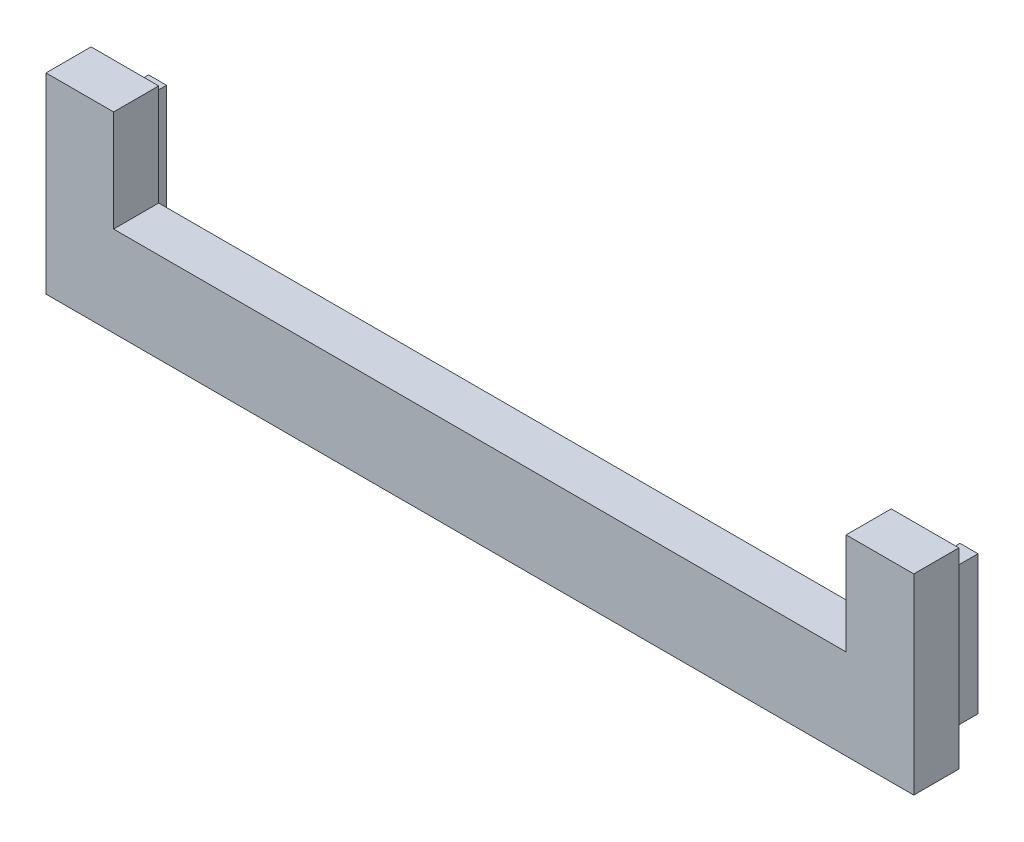
from build123d import *

# Parameters (mm, degrees)
SKETCH1_W           = 38.5
SKETCH1_H           = 8.5
BOSS_EXTRUDE1_DEPTH = 2
SKETCH2_W           = 0.8
SKETCH2_H           = 6.15
BOSS_EXTRUDE2_DEPTH = 1.7
SKETCH3_W           = 32.5
SKETCH3_H           = 4.5
CUT_EXTRUDE1_DEPTH  = 21.057791504


with BuildPart() as part:
    # Sketch1 → Boss-Extrude1 (new body)
    with BuildSketch(Plane.XY):
        Rectangle(SKETCH1_W, SKETCH1_H)
    extrude(amount=BOSS_EXTRUDE1_DEPTH)

    # Sketch2 → Boss-Extrude2 (add)
    with BuildSketch(Plane(origin=(0, 0, 0), x_dir=(-1, 0, 0), z_dir=(0, 0, -1))):
        with Locations((-18, -0.325)):
            Rectangle(SKETCH2_W, SKETCH2_H)
    boss_extrude2 = extrude(amount=BOSS_EXTRUDE2_DEPTH)

    # Mirror1: Boss-Extrude2 across plane
    add(boss_extrude2.mirror(Plane(origin=(0, 0, 0), x_dir=(0, 0, 1), z_dir=(1, 0, 0))))

    # Sketch3 → Cut-Extrude1 (cut, through all)
    with BuildSketch(Plane.XY.offset(2)):
        with Locations((0, 2)):
            Rectangle(SKETCH3_W, SKETCH3_H)
    extrude(amount=-CUT_EXTRUDE1_DEPTH, mode=Mode.SUBTRACT)


solid = part.part
